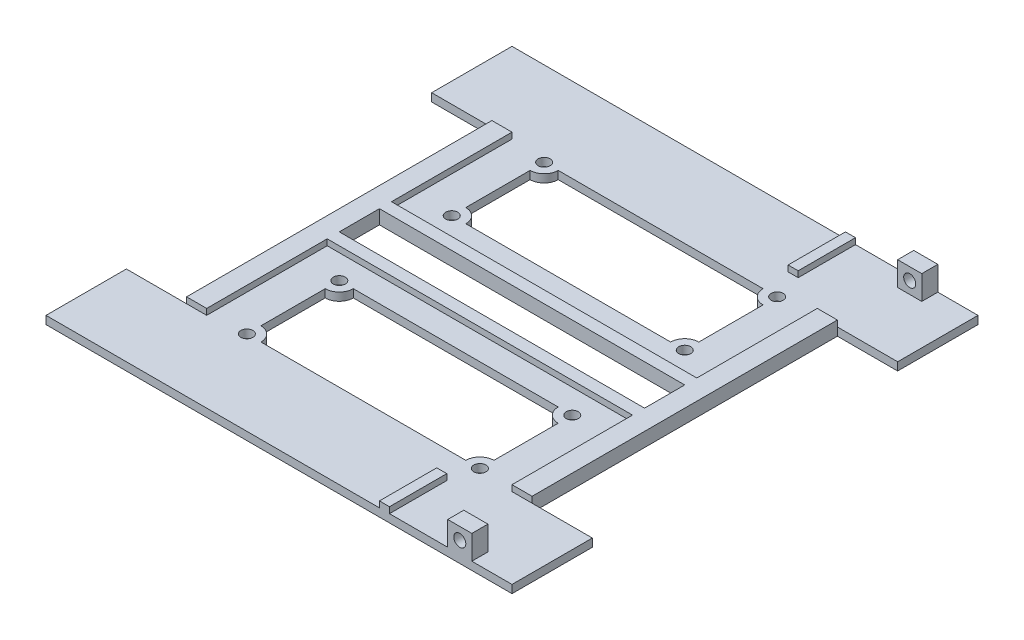
from build123d import *

# Parameters (mm, degrees)
SKETCH1_W                   = 116
SKETCH1_H                   = 116
BOSS_EXTRUDE1_DEPTH         = 2
CUT_EXTRUDE1_REACH          = 84.049
SKETCH2_W                   = 15
SKETCH2_H                   = 76
CIRPATTERN1_COUNT           = 2
CUT_EXTRUDE2_REACH          = 84.049
SKETCH3_R                   = 1.5
CUT_EXTRUDE3_REACH          = 84.049
SKETCH4_R                   = 1.5
LPATTERN1_COUNT             = 2
LPATTERN1_PITCH             = 23
CIRPATTERN2_COUNT           = 2
CIRPATTERN2_COPY_1_REACH    = 84.049
CIRPATTERN2_COPY_1_SKETCH_R = 1.5
CIRPATTERN2_COPY_2_REACH    = 84.049
CIRPATTERN2_COPY_2_SKETCH_R = 1.5
CUT_EXTRUDE4_REACH          = 84.049
SKETCH5_W                   = 76
SKETCH5_H                   = 16
SKETCH6_W                   = 6
SKETCH6_H                   = 4
BOSS_EXTRUDE2_DEPTH         = 6
CUT_EXTRUDE5_REACH          = 131.938
SKETCH7_R                   = 1.5
CUT_EXTRUDE7_REACH          = 84.244
SKETCH9_W                   = 5
SKETCH9_H                   = 76
BOSS_EXTRUDE3_DEPTH         = 1.5
SKETCH10_W                  = 76
SKETCH10_H                  = 3
BOSS_EXTRUDE4_DEPTH         = 3.5
SKETCH11_W                  = 2.5
SKETCH11_H                  = 14.264665063
BOSS_EXTRUDE5_DEPTH         = 1.5


with BuildPart() as part:
    # Sketch1 → Boss-Extrude1 (new body)
    with BuildSketch(Plane(origin=(0, 0, 0), x_dir=(1, 0, 0), z_dir=(0, 1, 0))):
        Rectangle(SKETCH1_W, SKETCH1_H)
    extrude(amount=BOSS_EXTRUDE1_DEPTH)

    # Sketch2 → Cut-Extrude1 (cut, up to next)
    with BuildSketch(Plane(origin=(0, 2, 0), x_dir=(1, 0, 0), z_dir=(0, 1, 0)), mode=Mode.PRIVATE) as cut_extrude1_sk1:
        with Locations((-50.5, 0)):
            Rectangle(SKETCH2_W, SKETCH2_H)
    cut_extrude1_tool1 = extrude(cut_extrude1_sk1.sketch, amount=-CUT_EXTRUDE1_REACH, mode=Mode.PRIVATE) & part.part
    cut_extrude1 = cut_extrude1_tool1.solids().sort_by_distance((-50.5, 2, 0))[0]
    add(cut_extrude1, mode=Mode.SUBTRACT)

    # CirPattern1: Cut-Extrude1 ×2 about axis
    cirpattern1_axis = Axis((0, 0, 0), (0, 1, 0))
    for i in range(1, CIRPATTERN1_COUNT):
        add(cut_extrude1.rotate(cirpattern1_axis, i * 360 / CIRPATTERN1_COUNT), mode=Mode.SUBTRACT)

    # Sketch3 → Cut-Extrude2 (cut, up to next)
    with BuildSketch(Plane(origin=(0, 2, 0), x_dir=(1, 0, 0), z_dir=(0, 1, 0)), mode=Mode.PRIVATE) as cut_extrude2_sk1:
        with Locations(Location((-29, 37, 0), (0, 0, 270))):
            Circle(SKETCH3_R)
    cut_extrude2_tool1 = extrude(cut_extrude2_sk1.sketch, amount=-CUT_EXTRUDE2_REACH, mode=Mode.PRIVATE) & part.part
    cut_extrude2 = cut_extrude2_tool1.solids().sort_by_distance((-29, 2, -37))[0]
    add(cut_extrude2, mode=Mode.SUBTRACT)

    # Sketch4 → Cut-Extrude3 (cut, up to next)
    with BuildSketch(Plane(origin=(0, 2, 0), x_dir=(1, 0, 0), z_dir=(0, 1, 0)), mode=Mode.PRIVATE) as cut_extrude3_sk1:
        with Locations(Location((29, 37, 0), (0, 0, 270))):
            Circle(SKETCH4_R)
    cut_extrude3_tool1 = extrude(cut_extrude3_sk1.sketch, amount=-CUT_EXTRUDE3_REACH, mode=Mode.PRIVATE) & part.part
    cut_extrude3 = cut_extrude3_tool1.solids().sort_by_distance((29, 2, -37))[0]
    add(cut_extrude3, mode=Mode.SUBTRACT)

    # LPattern1: Cut-Extrude2, Cut-Extrude3 ×2
    with Locations(*[(0, 0, i * LPATTERN1_PITCH) for i in range(1, LPATTERN1_COUNT)]):
        add(cut_extrude2, mode=Mode.SUBTRACT)
        add(cut_extrude3, mode=Mode.SUBTRACT)

    # CirPattern2: Cut-Extrude2, Cut-Extrude3 ×2 about axis
    cirpattern2_axis = Axis((0, 0, 0), (0, 1, 0))
    add([cut_extrude2.rotate(cirpattern2_axis, i * 360 / CIRPATTERN2_COUNT) for i in range(1, CIRPATTERN2_COUNT)], mode=Mode.SUBTRACT)
    add([cut_extrude3.rotate(cirpattern2_axis, i * 360 / CIRPATTERN2_COUNT) for i in range(1, CIRPATTERN2_COUNT)], mode=Mode.SUBTRACT)

    # CirPattern2 copy 1 sketch → CirPattern2 copy 1 (cut, up to next)
    with BuildSketch(Plane(origin=(0, 2, -23), x_dir=(-1, 0, 0), z_dir=(0, 1, 0)), mode=Mode.PRIVATE) as cirpattern2_copy_1_sk1:
        with Locations(Location((-29, 37, 0), (0, 0, 270))):
            Circle(CIRPATTERN2_COPY_1_SKETCH_R)
    cirpattern2_copy_1_tool1 = extrude(cirpattern2_copy_1_sk1.sketch, amount=-CIRPATTERN2_COPY_1_REACH, mode=Mode.PRIVATE) & part.part
    add(cirpattern2_copy_1_tool1.solids().sort_by_distance((29, 2, 14))[0], mode=Mode.SUBTRACT)

    # CirPattern2 copy 2 sketch → CirPattern2 copy 2 (cut, up to next)
    with BuildSketch(Plane(origin=(0, 2, -23), x_dir=(-1, 0, 0), z_dir=(0, 1, 0)), mode=Mode.PRIVATE) as cirpattern2_copy_2_sk1:
        with Locations(Location((29, 37, 0), (0, 0, 270))):
            Circle(CIRPATTERN2_COPY_2_SKETCH_R)
    cirpattern2_copy_2_tool1 = extrude(cirpattern2_copy_2_sk1.sketch, amount=-CIRPATTERN2_COPY_2_REACH, mode=Mode.PRIVATE) & part.part
    add(cirpattern2_copy_2_tool1.solids().sort_by_distance((-29, 2, 14))[0], mode=Mode.SUBTRACT)

    # Sketch5 → Cut-Extrude4 (cut, up to next)
    with BuildSketch(Plane(origin=(0, 2, 0), x_dir=(1, 0, 0), z_dir=(0, 1, 0)), mode=Mode.PRIVATE) as cut_extrude4_sk1:
        Rectangle(SKETCH5_W, SKETCH5_H)
    cut_extrude4_tool1 = extrude(cut_extrude4_sk1.sketch, amount=-CUT_EXTRUDE4_REACH, mode=Mode.PRIVATE) & part.part
    add(cut_extrude4_tool1.solids().sort_by_distance((0, 2, 0))[0], mode=Mode.SUBTRACT)

    # Sketch6 → Boss-Extrude2 (add)
    with BuildSketch(Plane(origin=(0, 2, 0), x_dir=(1, 0, 0), z_dir=(0, 1, 0))):
        with Locations((45, -56)):
            Rectangle(SKETCH6_W, SKETCH6_H)
    boss_extrude2 = extrude(amount=BOSS_EXTRUDE2_DEPTH)

    # Sketch7 → Cut-Extrude5 (cut, up to next)
    with BuildSketch(Plane.XY.offset(58), mode=Mode.PRIVATE) as cut_extrude5_sk1:
        with Locations((45, 5)):
            Circle(SKETCH7_R)
    cut_extrude5_tool1 = extrude(cut_extrude5_sk1.sketch, amount=-CUT_EXTRUDE5_REACH, mode=Mode.PRIVATE) & part.part
    cut_extrude5 = cut_extrude5_tool1.solids().sort_by_distance((45, 5, 58))[0]
    add(cut_extrude5, mode=Mode.SUBTRACT)

    # Mirror1: Boss-Extrude2, Cut-Extrude5 across plane
    add(boss_extrude2.mirror(Plane.XY))
    add(cut_extrude5.mirror(Plane.XY), mode=Mode.SUBTRACT)

    # Sketch8 → Cut-Extrude7 (cut, up to next)
    with BuildSketch(Plane(origin=(0, 2, 0), x_dir=(1, 0, 0), z_dir=(0, 1, 0)), mode=Mode.PRIVATE) as cut_extrude7_sk1:
        with BuildLine():
            ThreePointArc((-29, -33.5), (-26.525126266, -34.525126266), (-25.5, -37))
            Line((-25.5, -37), (25.5, -37))
            ThreePointArc((25.5, -37), (26.525126266, -34.525126266), (29, -33.5))
            Line((29, -33.5), (29, -17.5))
            ThreePointArc((29, -17.5), (26.525126266, -16.474873734), (25.5, -14))
            Line((25.5, -14), (-25.5, -14))
            ThreePointArc((-25.5, -14), (-26.525126266, -16.474873734), (-29, -17.5))
            Line((-29, -17.5), (-29, -33.5))
        make_face()
    cut_extrude7_tool1 = extrude(cut_extrude7_sk1.sketch, amount=-CUT_EXTRUDE7_REACH, mode=Mode.PRIVATE) & part.part
    cut_extrude7 = cut_extrude7_tool1.solids().sort_by_distance((0, 2, 25.5))[0]
    add(cut_extrude7, mode=Mode.SUBTRACT)

    # Mirror2: Cut-Extrude7 across plane
    add(cut_extrude7.mirror(Plane.XY), mode=Mode.SUBTRACT)

    # Sketch9 → Boss-Extrude3 (add)
    with BuildSketch(Plane(origin=(0, 2, 0), x_dir=(1, 0, 0), z_dir=(0, 1, 0))):
        with Locations((-40.5, 0)):
            Rectangle(SKETCH9_W, SKETCH9_H)
    boss_extrude3 = extrude(amount=BOSS_EXTRUDE3_DEPTH)

    # Mirror3: Boss-Extrude3 across plane
    add(boss_extrude3.mirror(Plane(origin=(0, 0, 0), x_dir=(0, 0, 1), z_dir=(1, 0, 0))))

    # Sketch10 → Boss-Extrude4 (add)
    with BuildSketch(Plane(origin=(0, 0, 0), x_dir=(-1, 0, 0), z_dir=(0, -1, 0))):
        with Locations((0, 6.5)):
            Rectangle(SKETCH10_W, SKETCH10_H)
    boss_extrude4 = extrude(amount=-BOSS_EXTRUDE4_DEPTH)

    # Mirror4: Boss-Extrude4 across plane
    add(boss_extrude4.mirror(Plane.XY))

    # Sketch11 → Boss-Extrude5 (add)
    with BuildSketch(Plane(origin=(0, 2, 0), x_dir=(1, 0, 0), z_dir=(0, 1, 0))):
        with Locations((26.25, -50.867667469)):
            Rectangle(SKETCH11_W, SKETCH11_H)
    boss_extrude5 = extrude(amount=BOSS_EXTRUDE5_DEPTH)

    # Mirror5: Boss-Extrude5 across plane
    add(boss_extrude5.mirror(Plane.XY))


solid = part.part
